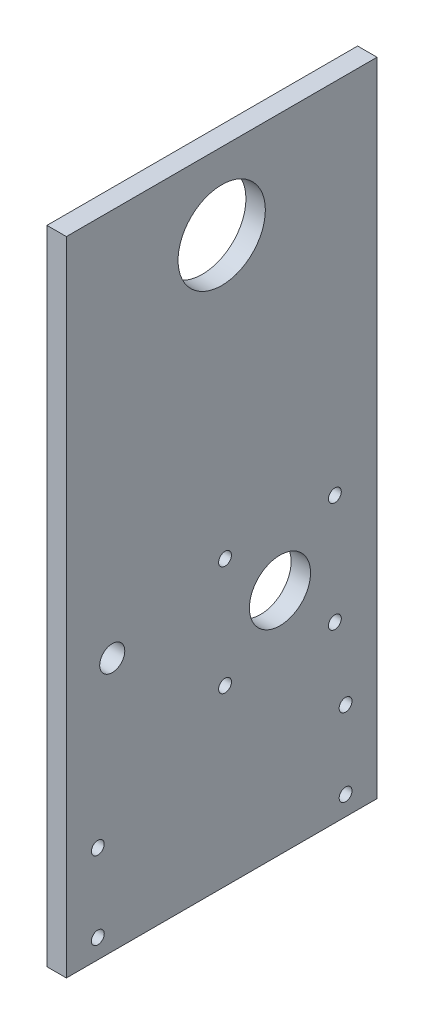
from build123d import *

# Parameters (mm, degrees)
SKETCH1_W           = 101.6
SKETCH1_H           = 210
SKETCH1_R           = 2.1
SKETCH1_R_2         = 10
SKETCH1_R_3         = 4.1
SKETCH1_R_4         = 14.275
BOSS_EXTRUDE1_DEPTH = 6.35


with BuildPart() as part:
    # Sketch1 → Boss-Extrude1 (new body)
    with BuildSketch(Plane(origin=(0, 0, 0), x_dir=(0, 0, -1), z_dir=(1, 0, 0))):
        Rectangle(SKETCH1_W, SKETCH1_H)
        with Locations((-40.513, -98.65)):
            Circle(SKETCH1_R, mode=Mode.SUBTRACT)
        with Locations((40.513, -98.65)):
            Circle(SKETCH1_R, mode=Mode.SUBTRACT)
        with Locations((19.05, -30.15)):
            Circle(SKETCH1_R_2, mode=Mode.SUBTRACT)
        with Locations((37.010512242, -12.189487758)):
            Circle(SKETCH1_R, mode=Mode.SUBTRACT)
        with Locations((1.089487758, -48.110512242)):
            Circle(SKETCH1_R, mode=Mode.SUBTRACT)
        with Locations((1.089487758, -12.189487758)):
            Circle(SKETCH1_R, mode=Mode.SUBTRACT)
        with Locations((37.010512242, -48.110512242)):
            Circle(SKETCH1_R, mode=Mode.SUBTRACT)
        with Locations((-35.8, -21.9)):
            Circle(SKETCH1_R_3, mode=Mode.SUBTRACT)
        with Locations((0, 80)):
            Circle(SKETCH1_R_4, mode=Mode.SUBTRACT)
        with Locations((-40.513, -73.25)):
            Circle(SKETCH1_R, mode=Mode.SUBTRACT)
        with Locations((40.513, -73.25)):
            Circle(SKETCH1_R, mode=Mode.SUBTRACT)
    extrude(amount=BOSS_EXTRUDE1_DEPTH)


solid = part.part
